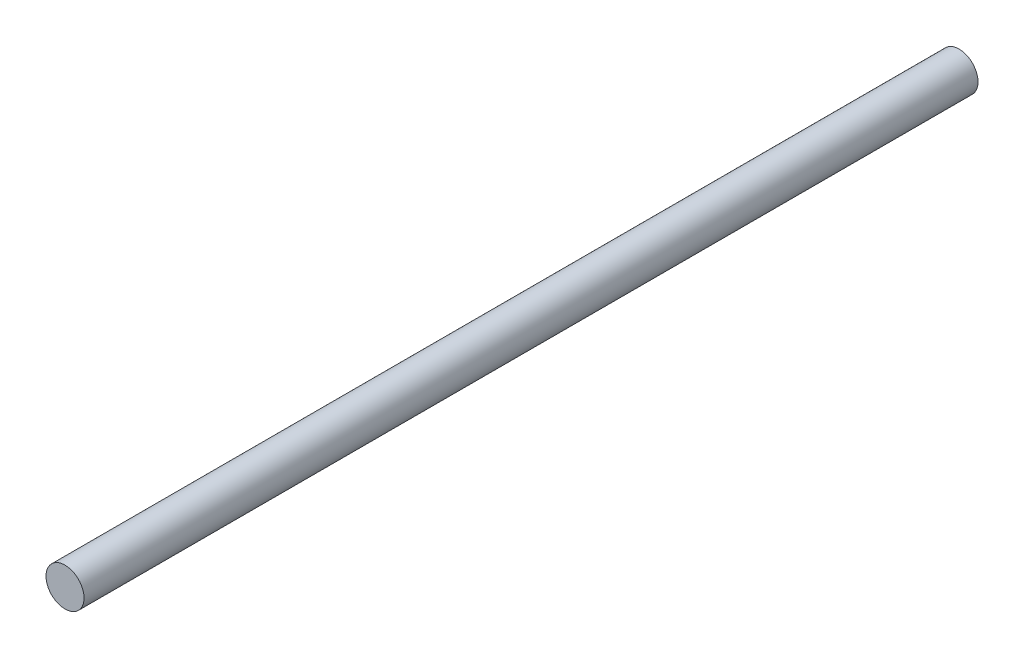
from build123d import *

# Parameters (mm, degrees)
SKETCH1_R           = 2.5
BOSS_EXTRUDE1_DEPTH = 117.5


with BuildPart() as part:
    # Sketch1 → Boss-Extrude1 (new body)
    with BuildSketch(Plane.XY):
        with Locations(Location((0, 0, 0), (0, 0, 180))):
            Circle(SKETCH1_R)
    extrude(amount=BOSS_EXTRUDE1_DEPTH)


solid = part.part
